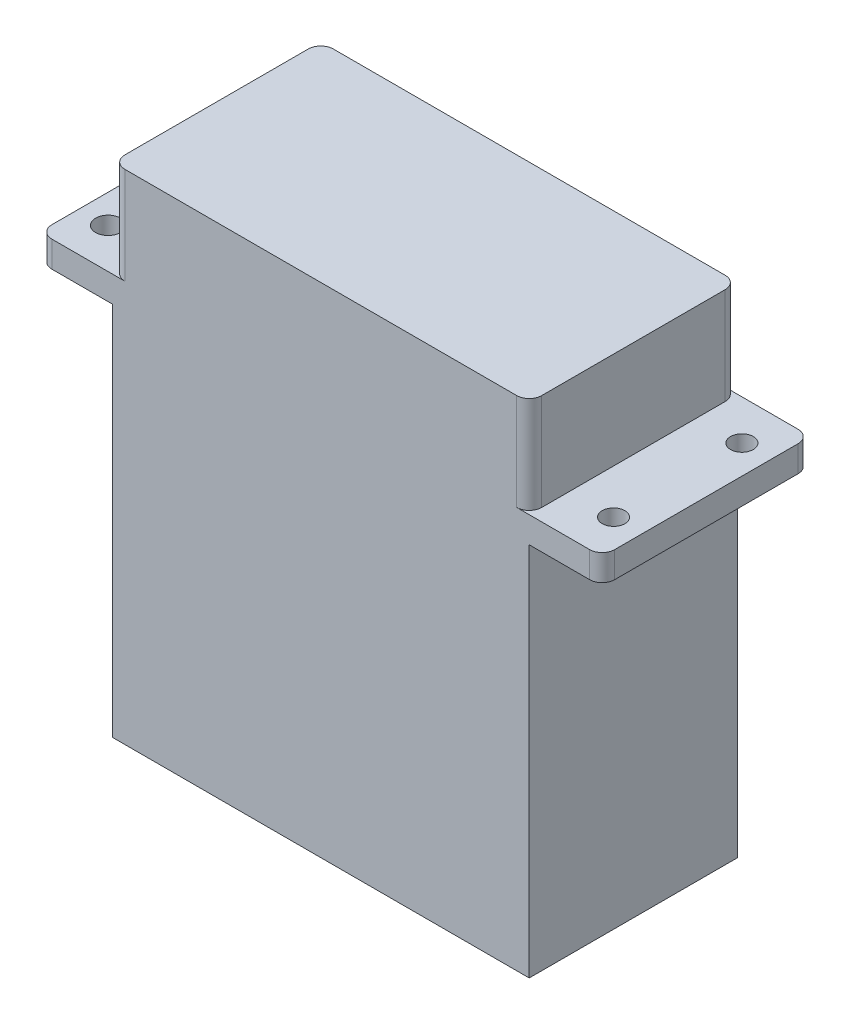
from build123d import *

# Parameters (mm, degrees)
SKETCH1_R           = 1.200027231
SKETCH1_R_2         = 1.087684018
BOSS_EXTRUDE1_DEPTH = 2.5
BOSS_EXTRUDE2_DEPTH = 9.3
SKETCH3_W           = 40
SKETCH3_H           = 20
BOSS_EXTRUDE3_DEPTH = 36


with BuildPart() as part:
    # Sketch1 → Boss-Extrude1 (new body)
    with BuildSketch(Plane(origin=(0, 0, 0), x_dir=(1, 0, 0), z_dir=(0, 1, 0))):
        with BuildLine():
            Line((1.2, 0), (52.8, 0))
            ThreePointArc((52.8, 0), (53.648528137, 0.351471863), (54, 1.2))
            Line((54, 1.2), (54, 18.8))
            ThreePointArc((54, 18.8), (53.648528137, 19.648528137), (52.8, 20))
            Line((52.8, 20), (1.2, 20))
            ThreePointArc((1.2, 20), (0.351471863, 19.648528137), (0, 18.8))
            Line((0, 18.8), (0, 1.2))
            ThreePointArc((0, 1.2), (0.351471863, 0.351471863), (1.2, 0))
        make_face()
        with Locations(Location((2.75, 16.159014692, 0), (0, 0, 270))):
            Circle(SKETCH1_R, mode=Mode.SUBTRACT)
        with Locations(Location((51.25, 16.159014692, 0), (0, 0, 270))):
            Circle(SKETCH1_R_2, mode=Mode.SUBTRACT)
        with Locations(Location((51.25, 3.840985308, 0), (0, 0, 90))):
            Circle(SKETCH1_R_2, mode=Mode.SUBTRACT)
        with Locations(Location((2.75, 3.840985308, 0), (0, 0, 90))):
            Circle(SKETCH1_R, mode=Mode.SUBTRACT)
    extrude(amount=BOSS_EXTRUDE1_DEPTH)

    # Sketch2 → Boss-Extrude2 (add)
    with BuildSketch(Plane(origin=(0, 2.5, 0), x_dir=(1, 0, 0), z_dir=(0, 1, 0))):
        with BuildLine():
            Line((8.2, 20), (45.8, 20))
            ThreePointArc((45.8, 20), (46.648528137, 19.648528137), (47, 18.8))
            Line((47, 18.8), (47, 1.2))
            ThreePointArc((47, 1.2), (46.648528137, 0.351471863), (45.8, 0))
            Line((45.8, 0), (8.2, 0))
            ThreePointArc((8.2, 0), (7.351471863, 0.351471863), (7, 1.2))
            Line((7, 1.2), (7, 18.8))
            ThreePointArc((7, 18.8), (7.351471863, 19.648528137), (8.2, 20))
        make_face()
    extrude(amount=BOSS_EXTRUDE2_DEPTH)

    # Sketch3 → Boss-Extrude3 (add)
    with BuildSketch(Plane.XZ):
        with Locations((27, -10)):
            Rectangle(SKETCH3_W, SKETCH3_H)
    extrude(amount=BOSS_EXTRUDE3_DEPTH)


solid = part.part
